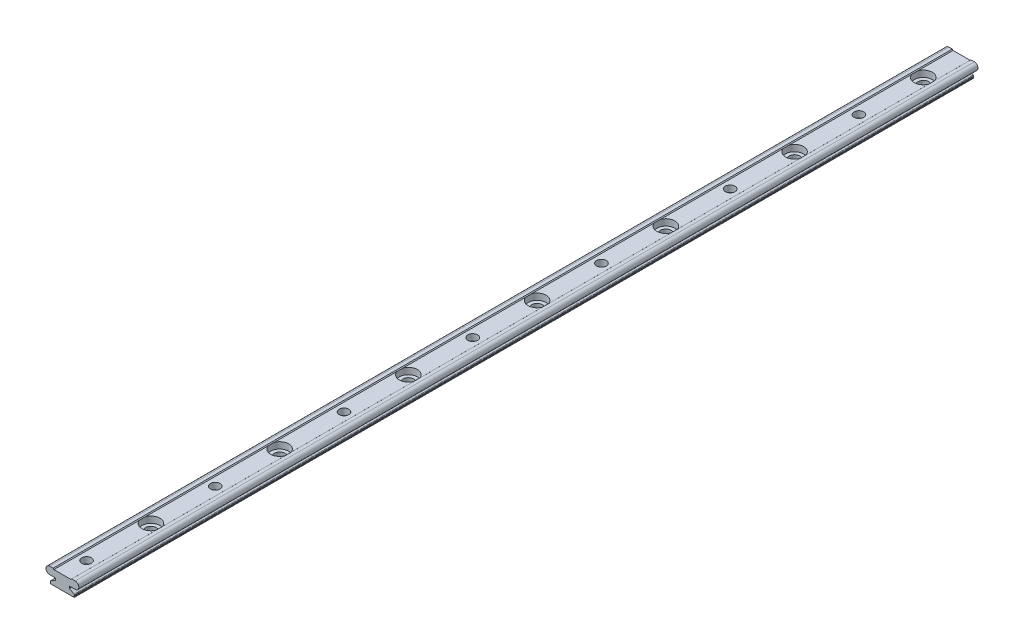
from build123d import *

# Parameters (mm, degrees)
BOSS_EXTRUDE1_DEPTH     = 335
CUT_EXTRUDE1_DEPTH      = 336.281493674
CUT_EXTRUDE1_DEPTH_BACK = 336.281493674
SKETCH4_W               = 0.254
SKETCH4_H               = 0.381
LPATTERN2_COUNT         = 17
LPATTERN2_PITCH         = 40
CUT_EXTRUDE2_DEPTH      = 336.268146414
CUT_EXTRUDE2_DEPTH_BACK = 336.268146414
SKETCH9_W               = 20.4
SKETCH9_H               = 111.2
SKETCH10_R              = 5.61975
CUT_EXTRUDE3_DEPTH      = 3.96875
F_1_4_CLEARANCE_HOLE1_D = 6.7564
LPATTERN3_COUNT         = 7
LPATTERN3_PITCH         = 80


with BuildPart() as part:
    # Sketch1 → Boss-Extrude1 (new, symmetric)
    with BuildSketch(Plane.XY):
        with BuildLine():
            Line((-7.925, 9.2), (-5.8, 9.2))
            Line((-5.8, 9.2), (-5.282234843, 8.7))
            Line((-5.282234843, 8.7), (5.282234843, 8.7))
            Line((5.282234843, 8.7), (5.8, 9.2))
            Line((5.8, 9.2), (7.925, 9.2))
            ThreePointArc((7.925, 9.2), (10.2, 6.925), (7.925, 4.65))
            Line((7.925, 4.65), (4.45, 4.65))
            Line((4.45, 4.65), (4.45, 3.360918321))
            Line((4.45, 3.360918321), (7.246, 1.746646968))
            ThreePointArc((7.246, 1.746646968), (7.431940905, 1.560706063), (7.5, 1.306706063))
            Line((7.5, 1.306706063), (7.5, 0.254))
            ThreePointArc((7.5, 0.254), (7.425605122, 0.074394878), (7.246, 0))
            Line((7.246, 0), (-7.246, 0))
            ThreePointArc((-7.246, 0), (-7.425605122, 0.074394878), (-7.5, 0.254))
            Line((-7.5, 0.254), (-7.5, 1.306706063))
            ThreePointArc((-7.5, 1.306706063), (-7.431940905, 1.560706063), (-7.246, 1.746646968))
            Line((-7.246, 1.746646968), (-4.45, 3.360918321))
            Line((-4.45, 3.360918321), (-4.45, 4.65))
            Line((-4.45, 4.65), (-7.925, 4.65))
            ThreePointArc((-7.925, 4.65), (-10.2, 6.925), (-7.925, 9.2))
        make_face()
    extrude(amount=BOSS_EXTRUDE1_DEPTH, both=True)

    # Sketch4 → Cut-Extrude1 (cut, two sides: drawn at the far end of the back side and taken through both)
    with BuildSketch(Plane.XY.offset(-CUT_EXTRUDE1_DEPTH_BACK)):
        with Locations((7.373, 0.8255)):
            Rectangle(SKETCH4_W, SKETCH4_H)
    extrude(amount=CUT_EXTRUDE1_DEPTH + CUT_EXTRUDE1_DEPTH_BACK, mode=Mode.SUBTRACT)

    # Sketch2 → Cut-Revolve1 (revolve, cut)
    with BuildSketch(Plane(origin=(0, 0, 0), x_dir=(0, 0, -1), z_dir=(1, 0, 0)), mode=Mode.PRIVATE) as cut_revolve1_sk:
        Polygon((-323, 8.7), (-323, 4.7), (-321.75, 4.7), (-321.75, 0), (-320, 0), (-320, 8.7), (-320, 9.2), (-323, 9.2), align=None)
    cut_revolve1 = revolve(cut_revolve1_sk.sketch.rotate(Axis((0, 0, 320), (0, 1, 0)), 180), axis=Axis((0, 0, 320), (0, 1, 0)), mode=Mode.SUBTRACT)

    # LPattern2: Cut-Revolve1 ×17
    with Locations(*[(0, 0, -i * LPATTERN2_PITCH) for i in range(1, LPATTERN2_COUNT)]):
        add(cut_revolve1, mode=Mode.SUBTRACT)

    # Sketch9 → Cut-Extrude2 (cut, two sides: drawn at the far end of the back side and taken through both)
    with BuildSketch(Plane(origin=(0, 8.7, 0), x_dir=(1, 0, 0), z_dir=(0, 1, 0)).offset(-CUT_EXTRUDE2_DEPTH_BACK)):
        with Locations((0, 279.4)):
            Rectangle(SKETCH9_W, SKETCH9_H)
    extrude(amount=CUT_EXTRUDE2_DEPTH + CUT_EXTRUDE2_DEPTH_BACK, mode=Mode.SUBTRACT)

    # Sketch10 → Cut-Extrude3 (cut)
    with BuildSketch(Plane(origin=(0, 8.7, 0), x_dir=(1, 0, 0), z_dir=(0, 1, 0))):
        with Locations(Location((0, 200, 0), (0, 0, 270))):
            Circle(SKETCH10_R)
    cut_extrude3 = extrude(amount=-CUT_EXTRUDE3_DEPTH, mode=Mode.SUBTRACT)

    # 1/4 Clearance Hole1 (through all)
    with Locations(Plane(origin=(0, 4.73125, 0), x_dir=(1, 0, 0), z_dir=(0, 1, 0))):
        with Locations((0, 200)):
            f_1_4_clearance_hole1 = Hole(F_1_4_CLEARANCE_HOLE1_D / 2)

    # LPattern3: Cut-Extrude3, 1/4 Clearance Hole1 ×7
    with Locations(*[(0, 0, i * LPATTERN3_PITCH) for i in range(1, LPATTERN3_COUNT)]):
        add(cut_extrude3, mode=Mode.SUBTRACT)
        add(f_1_4_clearance_hole1, mode=Mode.SUBTRACT)


solid = part.part
